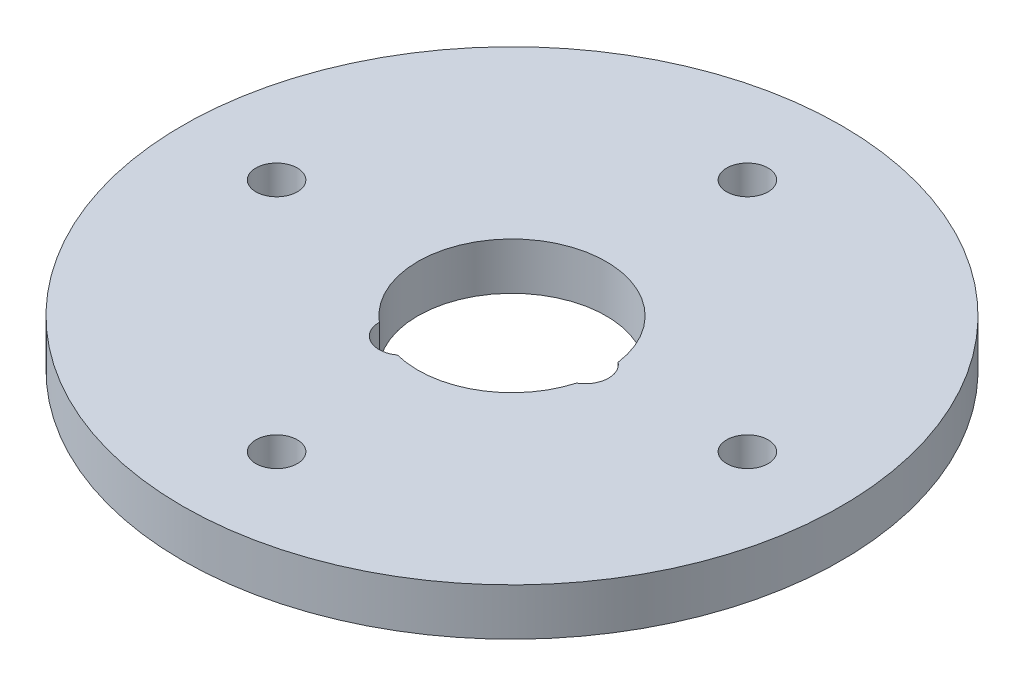
from build123d import *

# Parameters (mm, degrees)
SKETCH1_R               = 35
SKETCH1_R_2             = 2.2
SKETCH1_R_3             = 10
BOSS_EXTRUDE1_DEPTH     = 5
ECHELLE2_SCALE          = 2
ESQUISSE3_R             = 5
ENL_V_MAT_EXTRU_1_DEPTH = 10
ECHELLE3_SCALE          = 0.25


with BuildPart() as part:
    # Sketch1 → Boss-Extrude1 (new body)
    with BuildSketch(Plane(origin=(0, 0, 0), x_dir=(1, 0, 0), z_dir=(0, 1, 0))):
        with Locations(Location((0, 0, 0), (0, 0, 270))):
            Circle(SKETCH1_R)
        with Locations(Location((0, 25, 0), (0, 0, 270))):
            Circle(SKETCH1_R_2, mode=Mode.SUBTRACT)
        with Locations(Location((25, 0, 0), (0, 0, 270))):
            Circle(SKETCH1_R_2, mode=Mode.SUBTRACT)
        with Locations(Location((0, -25, 0), (0, 0, 270))):
            Circle(SKETCH1_R_2, mode=Mode.SUBTRACT)
        with Locations(Location((-25, 0, 0), (0, 0, 270))):
            Circle(SKETCH1_R_2, mode=Mode.SUBTRACT)
        with Locations(Location((0, 0, 0), (0, 0, 270))):
            Circle(SKETCH1_R_3, mode=Mode.SUBTRACT)
    extrude(amount=BOSS_EXTRUDE1_DEPTH)


with BuildPart() as part_1:
    # Echelle2: scaled about (0, 2.5, 0)
    add(part.part.scale(ECHELLE2_SCALE).moved(Location((0, -2.5, 0))))

    # Esquisse3 → Enlèv. mat.-Extru.1 (cut)
    with BuildSketch(Plane.XZ.offset(2.5)):
        with Locations((16.717937413, 1.193862082)):
            Circle(ESQUISSE3_R)
        with Locations((-7.898828439, 15.335211041)):
            Circle(ESQUISSE3_R)
    extrude(amount=-ENL_V_MAT_EXTRU_1_DEPTH, mode=Mode.SUBTRACT)


with BuildPart() as part_2:
    # Echelle3: scaled about (-0.005350728, 2.5, -0.020561043)
    add(part_1.part.scale(ECHELLE3_SCALE).moved(Location((-0.004013046, 1.875, -0.015420782))))


solid = part_2.part
